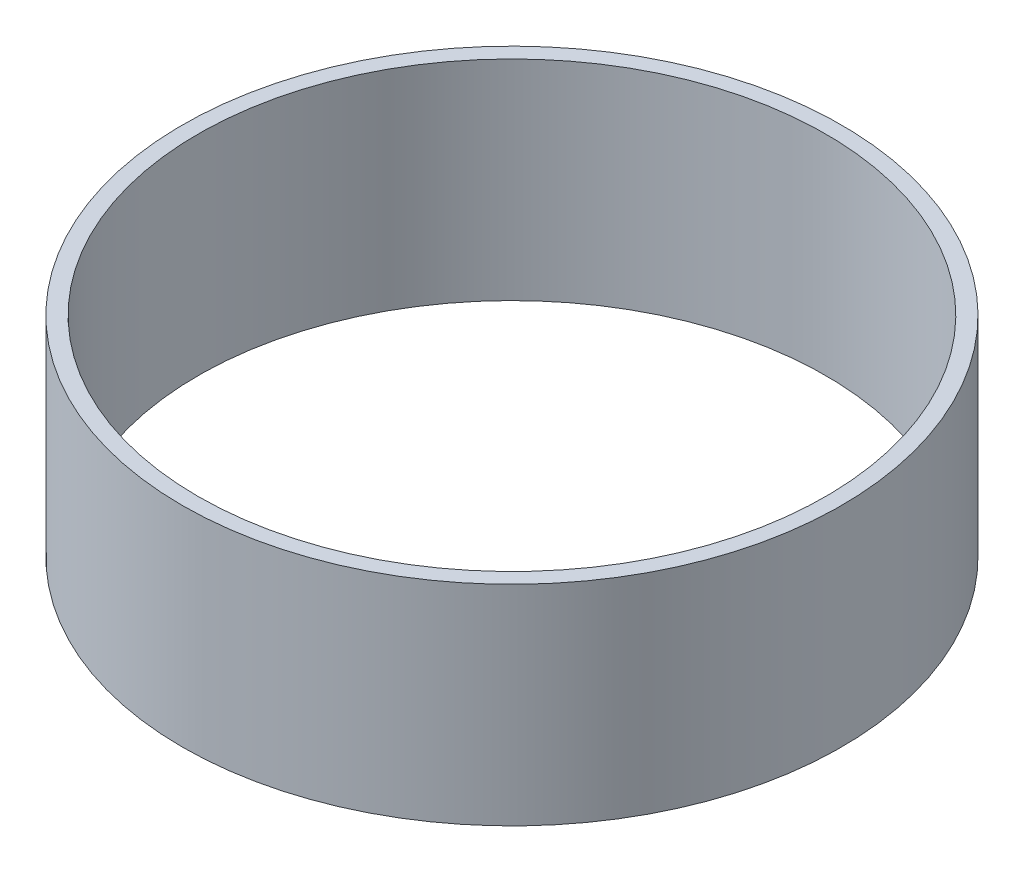
from build123d import *

# Parameters (mm, degrees)
SKETCH_1_R      = 63
SKETCH_1_R_2    = 60
EXTRUDE_1_DEPTH = 20


with BuildPart() as part:
    # 草图1 → 凸台-拉伸1 (new, symmetric)
    with BuildSketch(Plane(origin=(0, 0, 0), x_dir=(1, 0, 0), z_dir=(0, 1, 0))):
        with Locations(Location((0, 0, 0), (0, 0, 270))):
            Circle(SKETCH_1_R)
        with Locations(Location((0, 0, 0), (0, 0, 270))):
            Circle(SKETCH_1_R_2, mode=Mode.SUBTRACT)
    extrude(amount=EXTRUDE_1_DEPTH, both=True)


solid = part.part
